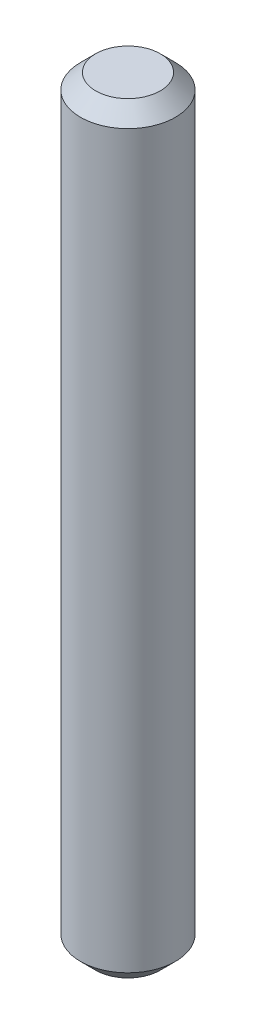
from build123d import *


with BuildPart() as part:
    # Sketch1 → Revolve1 (revolve)
    with BuildSketch(Plane(origin=(0, 0, 0), x_dir=(-1, 0, 0), z_dir=(0, 0, -1)), mode=Mode.PRIVATE) as revolve1_sk:
        Polygon((-1.07569, 0), (0, 0), (0, 25.4), (-1.07569, 25.4), (-1.58369, 24.892), (-1.58369, 0.508), align=None)
    revolve(revolve1_sk.sketch.rotate(Axis((0, 0, 0), (0, 1, 0)), 180), axis=Axis((0, 0, 0), (0, 1, 0)))


solid = part.part
